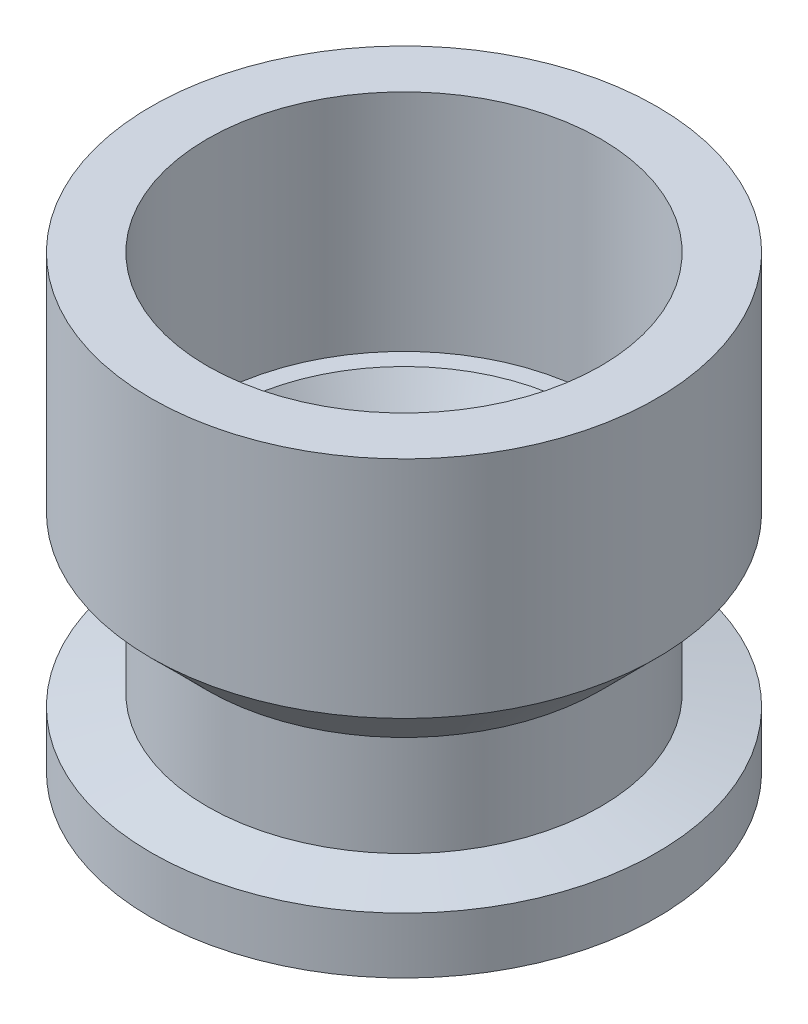
from build123d import *


with BuildPart() as part:
    # Sketch1 → Revolve1 (revolve)
    with BuildSketch(Plane.XY, mode=Mode.PRIVATE) as revolve1_sk:
        Polygon((2, 0), (4.5, 0), (4.5, 1), (3.5, 1.21013708), (3.5, 3), (4.5, 4), (4.5, 8), (3.5, 8), (3.5, 4), (3.171070948, 4), (2, 2), align=None)
    revolve(revolve1_sk.sketch.rotate(Axis((0, 0, 0), (0, 1, 0)), 90), axis=Axis((0, 0, 0), (0, 1, 0)))


solid = part.part
